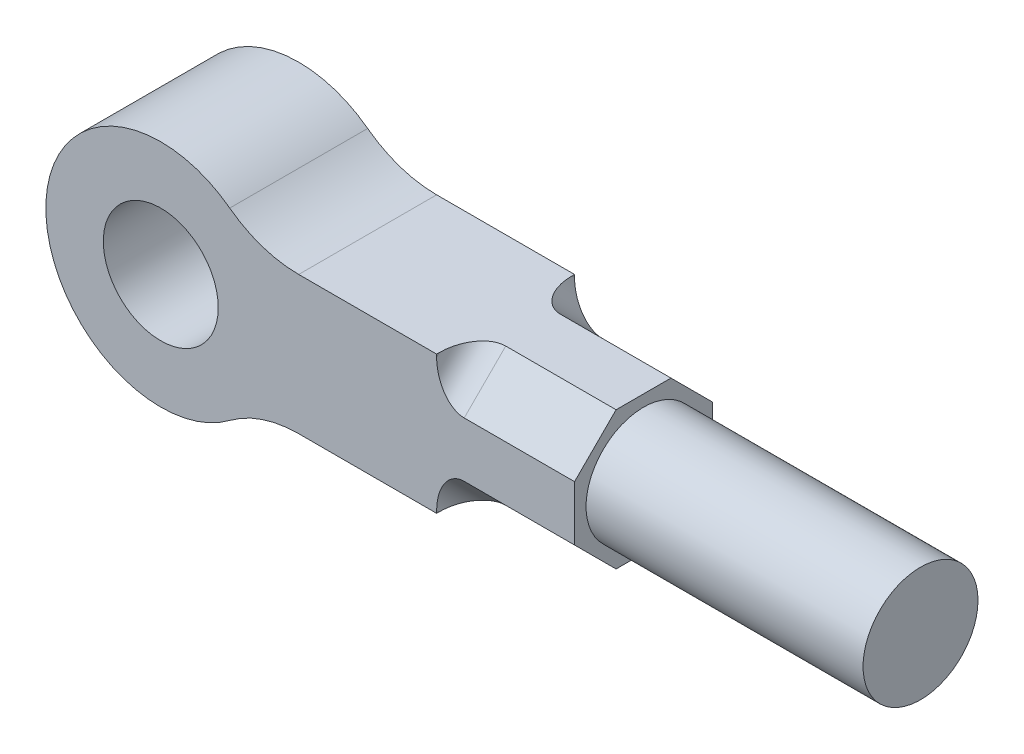
from build123d import *

# Parameters (mm, degrees)
SKETCH1_R           = 25
BOSS_EXTRUDE1_DEPTH = 60
CUT_EXTRUDE1_DEPTH  = 60
SKETCH2_3_R         = 25
BOSS_EXTRUDE2_DEPTH = 120.5
FILLET1_R           = 12


with BuildPart() as part:
    # Sketch1 → Boss-Extrude1 (new body)
    with BuildSketch(Plane.XY):
        with BuildLine():
            Line((60, 30), (180, 30))
            Line((180, 30), (180, -30))
            Line((180, -30), (60, -30))
            ThreePointArc((60, -30), (44.188611699, -32.565835097), (30, -40))
            ThreePointArc((30, -40), (-50, 0), (30, 40))
            ThreePointArc((30, 40), (44.188611699, 32.565835097), (60, 30))
        make_face()
        Circle(SKETCH1_R, mode=Mode.SUBTRACT)
    extrude(amount=BOSS_EXTRUDE1_DEPTH)

    # Sketch2 → Cut-Extrude1 (cut)
    with BuildSketch(Plane(origin=(180, 0, 0), x_dir=(0, 0, -1), z_dir=(1, 0, 0))):
        Polygon((-18.06, 30), (0, 11.94), (0, 30), align=None)
        Polygon((0, -30), (0, -11.94), (-18.06, -30), align=None)
        Polygon((-60, 11.94), (-41.94, 30), (-60, 30), align=None)
        Polygon((-60, -30), (-41.94, -30), (-60, -11.94), align=None)
    extrude(amount=-CUT_EXTRUDE1_DEPTH, mode=Mode.SUBTRACT)

    # Sketch2<3> → Boss-Extrude2 (add)
    with BuildSketch(Plane(origin=(180, 0, 0), x_dir=(0, 0, -1), z_dir=(1, 0, 0))):
        with Locations((-30, 0)):
            Circle(SKETCH2_3_R)
    extrude(amount=BOSS_EXTRUDE2_DEPTH)

    # Fillet1
    fillet1_edges = [part.edges().sort_by_distance(p)[0] for p in [
        (120, -20.97, 9.03),
        (120, 20.97, 9.03),
        (120, -20.97, 50.97),
        (120, 20.97, 50.97),
    ]]
    fillet(fillet1_edges, radius=FILLET1_R)


solid = part.part
